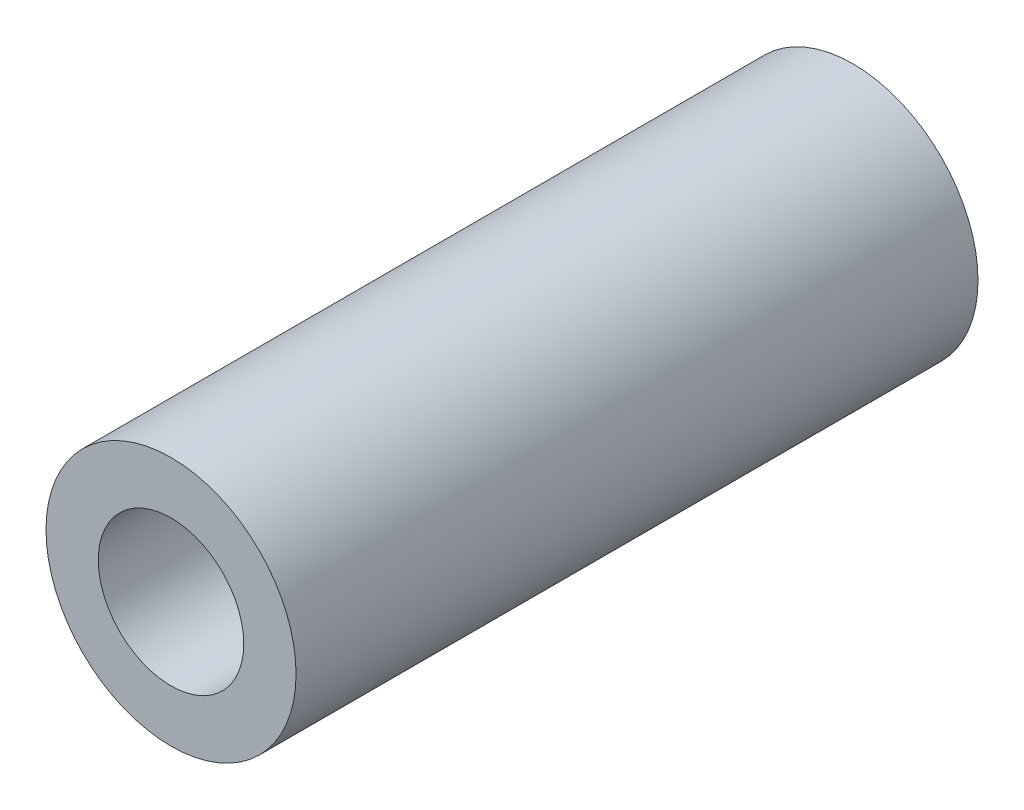
from build123d import *

# Parameters (mm, degrees)
SKETCH_1_R      = 2.75
SKETCH_1_R_2    = 1.6
EXTRUDE_1_DEPTH = 15


with BuildPart() as part:
    # 草圖1 → 填料-伸長1 (new body)
    with BuildSketch(Plane.XY):
        Circle(SKETCH_1_R)
        Circle(SKETCH_1_R_2, mode=Mode.SUBTRACT)
    extrude(amount=EXTRUDE_1_DEPTH)


solid = part.part
